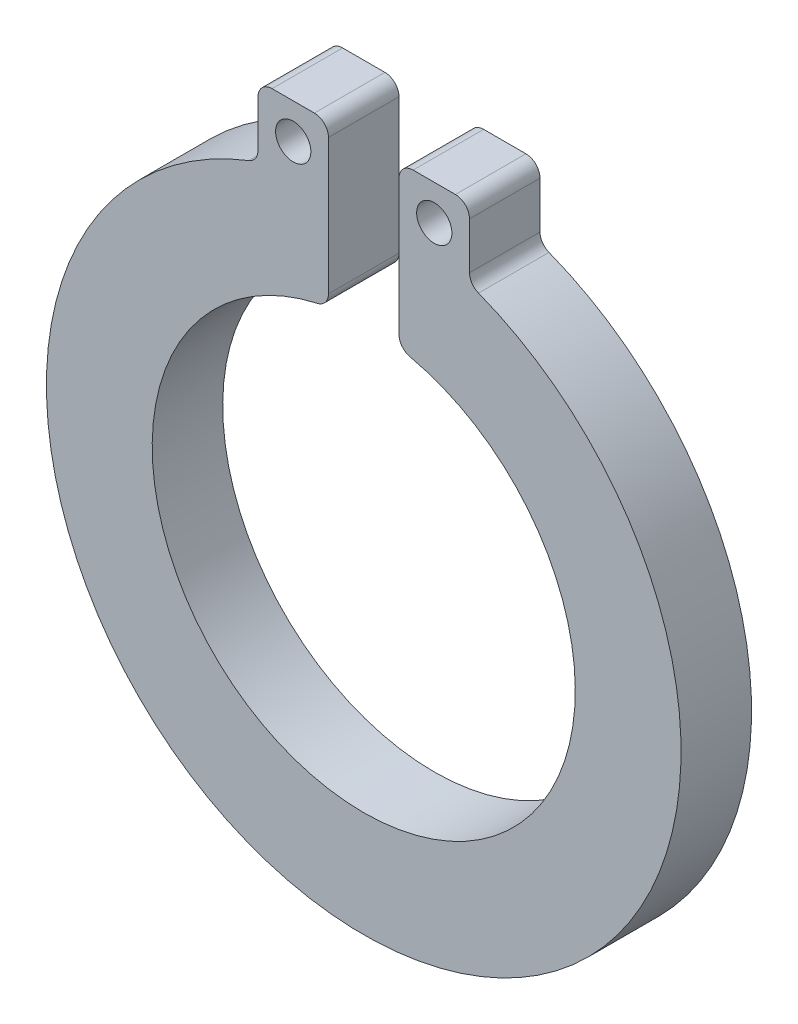
from build123d import *

# Parameters (mm, degrees)
SKETCH1_R           = 0.125
BOSS_EXTRUDE1_DEPTH = 0.5
FILLET1_R           = 0.1


with BuildPart() as part:
    # Sketch1 → Boss-Extrude1 (new body)
    with BuildSketch(Plane.XY):
        with BuildLine():
            Line((-0.25, 2.621320344), (-0.25, 1.479019946))
            ThreePointArc((-0.25, 1.479019946), (0, -1.5), (0.25, 1.479019946))
            Line((0.25, 1.479019946), (0.25, 2.621320344))
            Line((0.25, 2.621320344), (0.75, 2.621320344))
            Line((0.75, 2.621320344), (0.75, 2.121320344))
            ThreePointArc((0.75, 2.121320344), (0, -2.25), (-0.75, 2.121320344))
            Line((-0.75, 2.121320344), (-0.75, 2.621320344))
            Line((-0.75, 2.621320344), (-0.25, 2.621320344))
        make_face()
        with Locations((-0.5, 2.371320344)):
            Circle(SKETCH1_R, mode=Mode.SUBTRACT)
        with Locations((0.5, 2.371320344)):
            Circle(SKETCH1_R, mode=Mode.SUBTRACT)
    extrude(amount=BOSS_EXTRUDE1_DEPTH)

    # Fillet1
    fillet1_edges = [part.edges().sort_by_distance(p)[0] for p in [
        (-0.25, 2.621320344, 0.25),
        (-0.25, 1.479019946, 0.25),
        (0.25, 1.479019946, 0.25),
        (0.25, 2.621320344, 0.25),
        (0.75, 2.621320344, 0.25),
        (0.75, 2.121320344, 0.25),
        (-0.75, 2.121320344, 0.25),
        (-0.75, 2.621320344, 0.25),
    ]]
    fillet(fillet1_edges, radius=FILLET1_R)


solid = part.part
